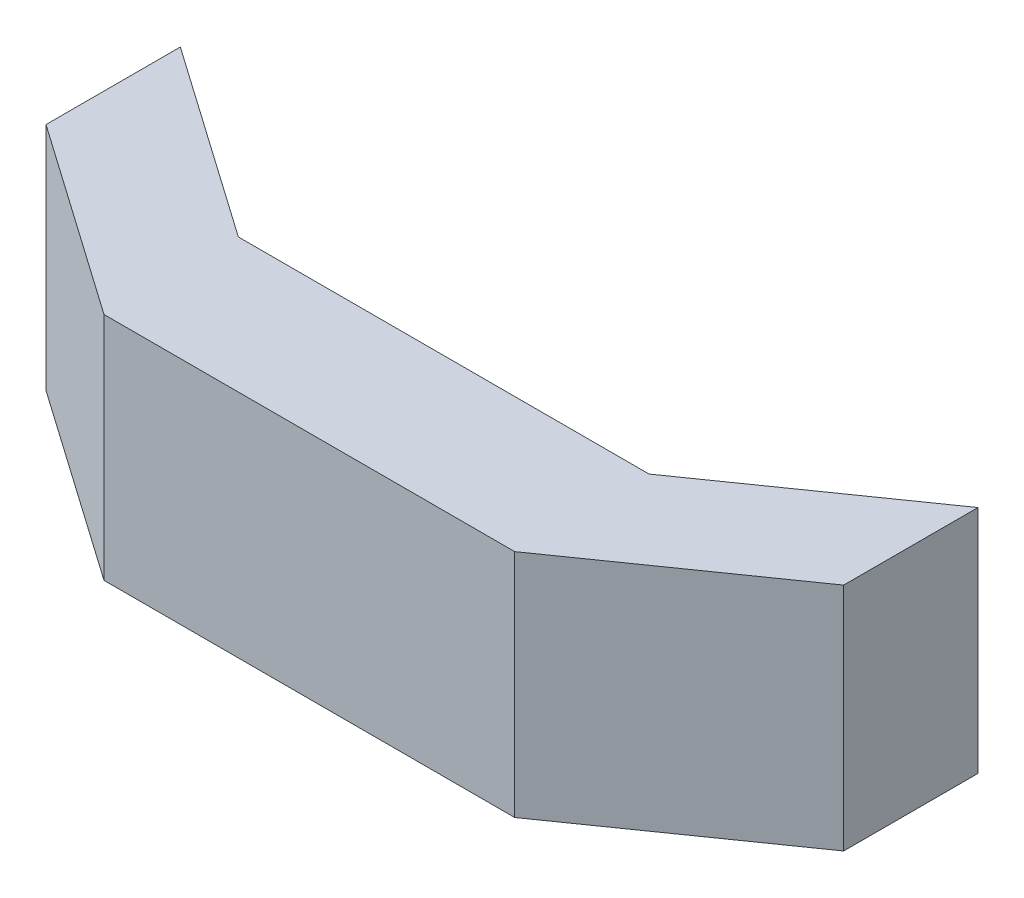
from build123d import *

# Parameters (mm, degrees)
BOSS_EXTRUDE1_DEPTH = 60


with BuildPart() as part:
    # Sketch1 → Boss-Extrude1 (new body)
    with BuildSketch(Plane(origin=(0, 0, 0), x_dir=(1, 0, 0), z_dir=(0, 1, 0))):
        Polygon((-53.5, 17.5), (-103.911022231, 52.798177775), (-103.911022231, 17.798177775), (-53.5, -17.5), (53.5, -17.5), (103.911022231, 17.798177775), (103.911022231, 52.798177775), (53.5, 17.5), align=None)
    extrude(amount=BOSS_EXTRUDE1_DEPTH)


solid = part.part
